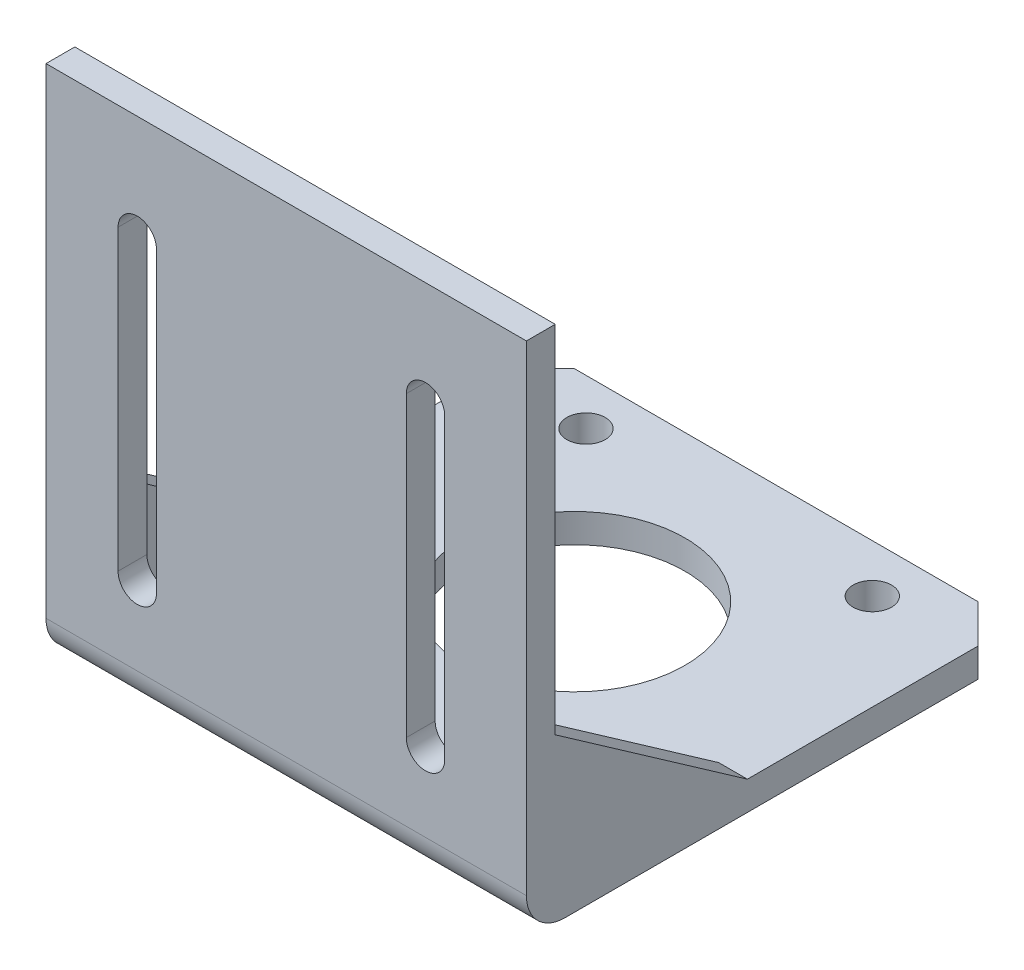
from build123d import *

# Parameters (mm, degrees)
SKETCH1_R           = 11.5
SKETCH1_R_2         = 2
BOSS_EXTRUDE1_DEPTH = 3
SKETCH2_W           = 50
SKETCH2_H           = 54
BOSS_EXTRUDE2_DEPTH = 3
FILLET1_R           = 4
FILLET2_R           = 2
BOSS_EXTRUDE3_DEPTH = 3


with BuildPart() as part:
    # Sketch1 → Boss-Extrude1 (new body)
    with BuildSketch(Plane(origin=(0, 0, 0), x_dir=(1, 0, 0), z_dir=(0, 1, 0))):
        Polygon((21, 23.797619048), (25, 19.797619048), (25, -24.202380952), (-25, -24.202380952), (-25, 19.797619048), (-21, 23.797619048), align=None)
        with Locations(Location((0, 2.797619048, 0), (0, 0, 270))):
            Circle(SKETCH1_R, mode=Mode.SUBTRACT)
        with Locations(Location((-15, 19, 0), (0, 0, 270))):
            Circle(SKETCH1_R_2, mode=Mode.SUBTRACT)
        with Locations(Location((15, 18.797619048, 0), (0, 0, 270))):
            Circle(SKETCH1_R_2, mode=Mode.SUBTRACT)
        with Locations(Location((15, -12.202380952, 0), (0, 0, 270))):
            Circle(SKETCH1_R_2, mode=Mode.SUBTRACT)
        with Locations(Location((-15, -12.202380952, 0), (0, 0, 270))):
            Circle(SKETCH1_R_2, mode=Mode.SUBTRACT)
    extrude(amount=BOSS_EXTRUDE1_DEPTH)

    # Sketch2 → Boss-Extrude2 (add)
    with BuildSketch(Plane.XY.offset(24.202380952)):
        with Locations((0, 27)):
            Rectangle(SKETCH2_W, SKETCH2_H)
        with BuildLine():
            Line((-17.5, 43), (-17.5, 12))
            ThreePointArc((-17.5, 12), (-15.5, 10), (-13.5, 12))
            Line((-13.5, 12), (-13.5, 43))
            ThreePointArc((-13.5, 43), (-15.5, 45), (-17.5, 43))
        make_face(mode=Mode.SUBTRACT)
        with BuildLine():
            Line((12.5, 43), (12.5, 12))
            ThreePointArc((12.5, 12), (14.5, 10), (16.5, 12))
            Line((16.5, 12), (16.5, 43))
            ThreePointArc((16.5, 43), (14.5, 45), (12.5, 43))
        make_face(mode=Mode.SUBTRACT)
    extrude(amount=BOSS_EXTRUDE2_DEPTH)

    # Fillet1
    fillet1_edges = [part.edges().sort_by_distance(p)[0] for p in [
        (0, 0, 27.202380952),
    ]]
    fillet(fillet1_edges, radius=FILLET1_R)

    # Fillet2
    fillet2_edges = [part.edges().sort_by_distance(p)[0] for p in [
        (0, 3, 24.202380952),
    ]]
    fillet(fillet2_edges, radius=FILLET2_R)

    # Sketch6 → Boss-Extrude3 (add)
    with BuildSketch(Plane(origin=(25, 0, 0), x_dir=(0, 0, -1), z_dir=(1, 0, 0))):
        Polygon((-24.202380952, 3), (-24.202380952, 17), (-4.202380952, 3), align=None)
    boss_extrude3 = extrude(amount=-BOSS_EXTRUDE3_DEPTH)

    # Mirror1: Boss-Extrude3 across plane
    add(boss_extrude3.mirror(Plane(origin=(0, 0, 0), x_dir=(0, 0, 1), z_dir=(1, 0, 0))))


solid = part.part
